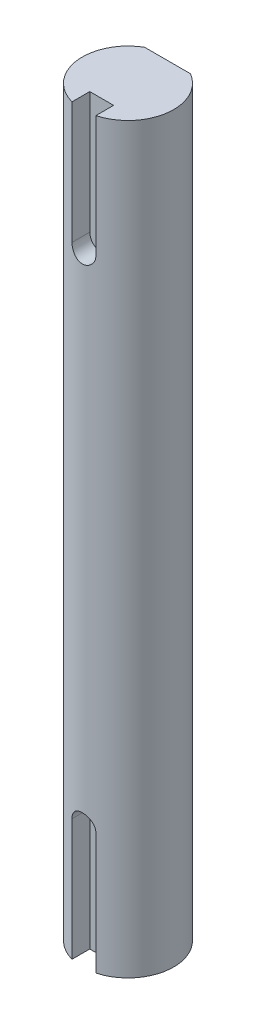
from build123d import *

# Parameters (mm, degrees)
BOSS_EXTRUDE1_DEPTH      = 38.735
BOSS_EXTRUDE1_DEPTH_BACK = 38.735
CUT_EXTRUDE4_DEPTH       = 40.625695711


with BuildPart() as part:
    # Sketch1 → Boss-Extrude1 (new, two sides: drawn at the far end of the back side and taken through both)
    with BuildSketch(Plane(origin=(0, 0, 0), x_dir=(1, 0, 0), z_dir=(0, 1, 0)).offset(-BOSS_EXTRUDE1_DEPTH_BACK)):
        with BuildLine():
            Line((2.3876, 4.120773288), (-2.3876, 4.120773288))
            ThreePointArc((-2.3876, 4.120773288), (-2.378072881, -4.126278665), (4.7625, 0))
            ThreePointArc((4.7625, 0), (4.126278665, 2.378072881), (2.3876, 4.120773288))
        make_face()
    extrude(amount=BOSS_EXTRUDE1_DEPTH + BOSS_EXTRUDE1_DEPTH_BACK)

    # Sketch4 → Cut-Extrude4 (cut, through all)
    with BuildSketch(Plane.XY.offset(2.7432)):
        with BuildLine():
            Line((-1.2446, -26.035), (-1.2446, -38.735))
            Line((-1.2446, -38.735), (1.2446, -38.735))
            Line((1.2446, -38.735), (1.2446, -26.035))
            ThreePointArc((1.2446, -26.035), (0, -27.2796), (-1.2446, -26.035))
        make_face()
        with BuildLine():
            ThreePointArc((1.2446, -26.035), (0, -24.7904), (-1.2446, -26.035))
            Line((-1.2446, -26.035), (1.2446, -26.035))
        make_face()
        with BuildLine():
            Line((1.2446, -26.035), (-1.2446, -26.035))
            ThreePointArc((-1.2446, -26.035), (0, -27.2796), (1.2446, -26.035))
        make_face()
        with BuildLine():
            Line((1.2446, 38.735), (-1.2446, 38.735))
            Line((-1.2446, 38.735), (-1.2446, 26.035))
            ThreePointArc((-1.2446, 26.035), (0, 27.2796), (1.2446, 26.035))
            Line((1.2446, 26.035), (1.2446, 38.735))
        make_face()
        with BuildLine():
            ThreePointArc((1.2446, 26.035), (0, 27.2796), (-1.2446, 26.035))
            Line((-1.2446, 26.035), (1.2446, 26.035))
        make_face()
        with BuildLine():
            Line((1.2446, 26.035), (-1.2446, 26.035))
            ThreePointArc((-1.2446, 26.035), (0, 24.7904), (1.2446, 26.035))
        make_face()
    extrude(amount=CUT_EXTRUDE4_DEPTH, mode=Mode.SUBTRACT)


solid = part.part
